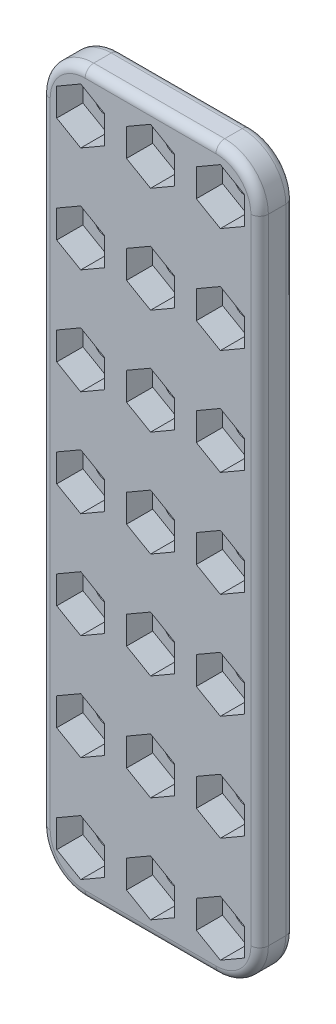
from build123d import *

# Parameters (mm, degrees)
SKETCH_1_W             = 25
SKETCH_1_H             = 10
EXTRUDE_1_DEPTH        = 4
SKETCH_2_R             = 1.5
CUT_EXTRUDE_1_DEPTH    = 15.044571905
CUT_EXTRUDE_2_DEPTH    = 3
SKETCH_4_W             = 25
SKETCH_4_H             = 12.1
EXTRUDE_2_DEPTH        = 4
SKETCH_5_R             = 1.5
CUT_EXTRUDE_3_DEPTH    = 22.55597365
CUT_EXTRUDE_4_DEPTH    = 3
PATTERN_LINEAR_1_COUNT = 6
PATTERN_LINEAR_1_PITCH = 12.1
FILLET_1_R             = 5
FILLET_2_R             = 1


with BuildPart() as part:
    # 草图1 → 凸台-拉伸1 (new body)
    with BuildSketch(Plane.XY):
        Rectangle(SKETCH_1_W, SKETCH_1_H)
    extrude(amount=EXTRUDE_1_DEPTH)

    # 草图2 → 切除-拉伸1 (cut, through all)
    with BuildSketch(Plane.XY.offset(4)):
        Circle(SKETCH_2_R)
        with Locations((-8, 0)):
            Circle(SKETCH_2_R)
        with Locations(Location((8, 0, 0), (0, 0, 180))):
            Circle(SKETCH_2_R)
    extrude(amount=-CUT_EXTRUDE_1_DEPTH, mode=Mode.SUBTRACT)

    # 草图3 → 切除-拉伸2 (cut)
    with BuildSketch(Plane.XY.offset(4)):
        Polygon((-8, 3.175426481), (-10.75, 1.58771324), (-10.75, -1.58771324), (-8, -3.175426481), (-5.25, -1.58771324), (-5.25, 1.58771324), align=None)
        Polygon((0, 3.175426481), (-2.75, 1.58771324), (-2.75, -1.58771324), (0, -3.175426481), (2.75, -1.58771324), (2.75, 1.58771324), align=None)
        Polygon((8, 3.175426481), (5.25, 1.58771324), (5.25, -1.58771324), (8, -3.175426481), (10.75, -1.58771324), (10.75, 1.58771324), align=None)
    extrude(amount=-CUT_EXTRUDE_2_DEPTH, mode=Mode.SUBTRACT)

    # 草图4 → 凸台-拉伸2 (add)
    with BuildSketch(Plane.XY.offset(4)):
        with Locations((0, -11.05)):
            Rectangle(SKETCH_4_W, SKETCH_4_H)
    extrude_2 = extrude(amount=-EXTRUDE_2_DEPTH)

    # 草图5 → 切除-拉伸3 (cut, through all)
    with BuildSketch(Plane.XY.offset(4)):
        with Locations((0, -12.1)):
            Circle(SKETCH_5_R)
        with Locations((-8, -12.1)):
            Circle(SKETCH_5_R)
        with Locations(Location((8, -12.1, 0), (0, 0, 180))):
            Circle(SKETCH_5_R)
    cut_extrude_3 = extrude(amount=-CUT_EXTRUDE_3_DEPTH, mode=Mode.SUBTRACT)

    # 草图6 → 切除-拉伸4 (cut)
    with BuildSketch(Plane.XY.offset(4)):
        Polygon((-8, -8.924573519), (-10.75, -10.51228676), (-10.75, -13.68771324), (-8, -15.275426481), (-5.25, -13.68771324), (-5.25, -10.51228676), align=None)
        Polygon((0, -8.924573519), (-2.75, -10.51228676), (-2.75, -13.68771324), (0, -15.275426481), (2.75, -13.68771324), (2.75, -10.51228676), align=None)
        Polygon((8, -8.924573519), (5.25, -10.51228676), (5.25, -13.68771324), (8, -15.275426481), (10.75, -13.68771324), (10.75, -10.51228676), align=None)
    cut_extrude_4 = extrude(amount=-CUT_EXTRUDE_4_DEPTH, mode=Mode.SUBTRACT)

    # 阵列(线性)1: 凸台-拉伸2, 切除-拉伸3, 切除-拉伸4 ×6
    with Locations(*[(0, -i * PATTERN_LINEAR_1_PITCH, 0) for i in range(1, PATTERN_LINEAR_1_COUNT)]):
        add(extrude_2)
        add(cut_extrude_3, mode=Mode.SUBTRACT)
        add(cut_extrude_4, mode=Mode.SUBTRACT)

    # 圆角1
    fillet_1_edges = [part.edges().sort_by_distance(p)[0] for p in [
        (-12.5, -77.6, 2),
        (12.5, -77.6, 2),
        (-12.5, 5, 2),
        (12.5, 5, 2),
    ]]
    fillet(fillet_1_edges, radius=FILLET_1_R)

    # 圆角2
    fillet_2_edges = [part.edges().sort_by_distance(p)[0] for p in [
        (0, -77.6, 0),
        (0, -77.6, 4),
        (12.5, -36.3, 4),
        (0, 5, 4),
        (-12.5, -36.3, 4),
        (-11.035533906, -76.135533906, 4),
        (-11.035533906, 3.535533906, 4),
        (11.035533906, 3.535533906, 4),
        (11.035533906, -76.135533906, 4),
        (12.5, -36.3, 0),
        (-12.5, -36.3, 0),
        (0, 5, 0),
        (-11.035533906, -76.135533906, 0),
        (-11.035533906, 3.535533906, 0),
        (11.035533906, 3.535533906, 0),
        (11.035533906, -76.135533906, 0),
    ]]
    fillet(fillet_2_edges, radius=FILLET_2_R)


solid = part.part
